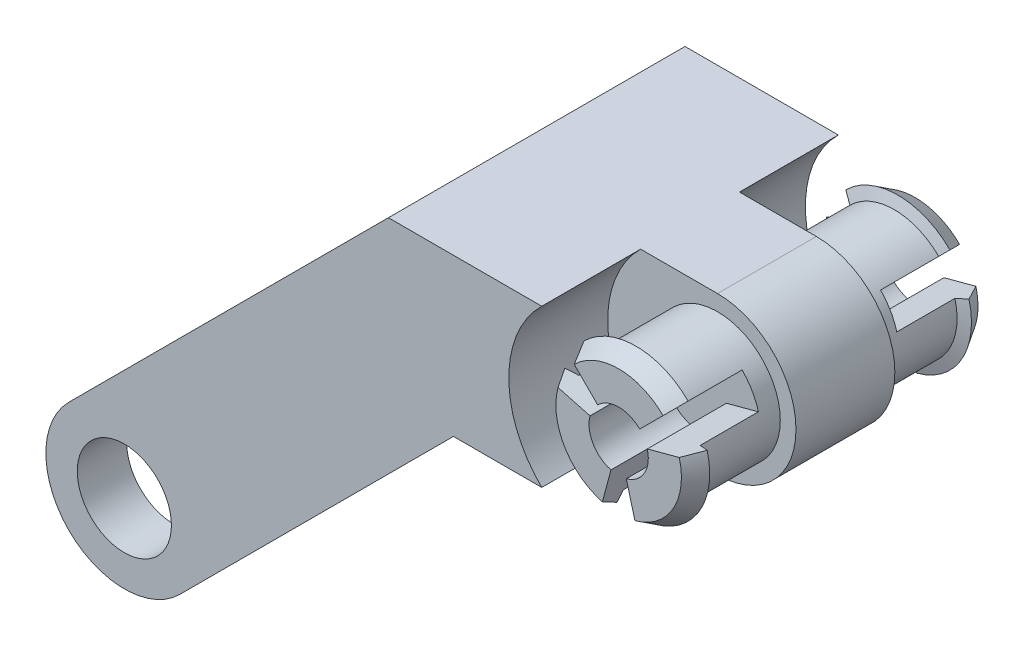
from build123d import *

# Parameters (mm, degrees)
CROQUIS1_R              = 3.96875
SALIENTE_EXTRUIR1_DEPTH = 7.5
CROQUIS2_W              = 2.5
CROQUIS2_H              = 3.96875
CORTAR_EXTRUIR1_DEPTH   = 15
CROQUIS4_R              = 2.38125
CORTAR_EXTRUIR2_DEPTH   = 15
CROQUIS5_R              = 5.55625
CORTAR_EXTRUIR3_DEPTH   = 5
CROQUIS8_W              = 1
CROQUIS8_H              = 1.5
CORTAR_EXTRUIR6_DEPTH   = 4
CROQUIS10_R             = 4
CROQUIS10_R_2           = 1.5
CORTAR_EXTRUIR7_DEPTH   = 1.5


with BuildPart() as part:
    # Croquis1 → Saliente-Extruir1 (new, symmetric)
    with BuildSketch(Plane.XY):
        Circle(CROQUIS1_R)
        with BuildLine():
            Line((13.356089924, 18.96875), (-2.806330038, 2.806330038))
            ThreePointArc((-2.806330038, 2.806330038), (1.518774872, 3.666646895), (3.96875, 0))
            ThreePointArc((3.96875, 0), (3.666646895, -1.518774872), (2.806330038, -2.806330038))
            Line((2.806330038, -2.806330038), (16.643910076, 11.03125))
            Line((16.643910076, 11.03125), (25, 11.03125))
            ThreePointArc((25, 11.03125), (21.03125, 15), (25, 18.96875))
            Line((25, 18.96875), (13.356089924, 18.96875))
        make_face()
        with BuildLine():
            ThreePointArc((28.96875, 15), (27.806330038, 17.806330038), (25, 18.96875))
            Line((25, 18.96875), (25, 11.03125))
            ThreePointArc((25, 11.03125), (27.806330038, 12.193669962), (28.96875, 15))
        make_face()
        with BuildLine():
            Line((25, 11.03125), (25, 18.96875))
            ThreePointArc((25, 18.96875), (21.03125, 15), (25, 11.03125))
        make_face()
        with BuildLine():
            ThreePointArc((28.96875, 15), (27.806330038, 17.806330038), (25, 18.96875))
            Line((25, 18.96875), (25, 11.03125))
            ThreePointArc((25, 11.03125), (27.806330038, 12.193669962), (28.96875, 15))
        make_face()
        with BuildLine():
            Line((25, 11.03125), (25, 18.96875))
            ThreePointArc((25, 18.96875), (21.03125, 15), (25, 11.03125))
        make_face()
    extrude(amount=SALIENTE_EXTRUIR1_DEPTH, both=True)

    # Croquis2 → Cortar-Extruir1 (cut)
    with BuildSketch(Plane(origin=(-2.806330038, 2.806330038, 0), x_dir=(0, 0, 1), z_dir=(-0.7071067811865441, 0.7071067811865509, 0))):
        with Locations((-3.75, -1.984375)):
            Rectangle(CROQUIS2_W, CROQUIS2_H)
        with Locations((3.75, -1.984375)):
            Rectangle(CROQUIS2_W, CROQUIS2_H)
    extrude(amount=-CORTAR_EXTRUIR1_DEPTH, mode=Mode.SUBTRACT)

    # Croquis4 → Cortar-Extruir2 (cut)
    with BuildSketch(Plane.XY.offset(7.5)):
        Circle(CROQUIS4_R)
    extrude(amount=-CORTAR_EXTRUIR2_DEPTH, mode=Mode.SUBTRACT)

    # Croquis5 → Cortar-Extruir3 (cut)
    with BuildSketch(Plane.XY.offset(7.5)):
        with Locations((25, 15)):
            Circle(CROQUIS5_R)
    cortar_extruir3 = extrude(amount=-CORTAR_EXTRUIR3_DEPTH, mode=Mode.SUBTRACT)

    # Simetría1: Cortar-Extruir3 across plane
    add(cortar_extruir3.mirror(Plane.XY), mode=Mode.SUBTRACT)

    # Croquis8 → Revolución1 (revolve)
    with BuildSketch(Plane(origin=(25, 0, 0), x_dir=(0, 0, -1), z_dir=(1, 0, 0)), mode=Mode.PRIVATE) as revoluci_n1_sk:
        Polygon((7.5, 18.175), (7.5, 16.5), (2.5, 16.5), (2.5, 18.175), (6.441294167, 18.175), (6.62, 18.725), align=None)
        with Locations((3, 15.75)):
            Rectangle(CROQUIS8_W, CROQUIS8_H)
    revoluci_n1 = revolve(revoluci_n1_sk.sketch.rotate(Axis((25, 15, -2.5), (0, 0, -1)), 90), axis=Axis((25, 15, -2.5), (0, 0, -1)))

    # Croquis9 → Cortar-Extruir6 (cut)
    with BuildSketch(Plane(origin=(0, 0, -7.5), x_dir=(-1, 0, 0), z_dir=(0, 0, -1))):
        with BuildLine():
            Line((-23.777080012, 10.436000471), (-25, 15))
            Line((-25, 15), (-26.222919988, 10.436000471))
            ThreePointArc((-26.222919988, 10.436000471), (-25, 10.275), (-23.777080012, 10.436000471))
        make_face()
        with BuildLine():
            Line((-29.563999529, 16.222919988), (-25, 15))
            Line((-25, 15), (-28.341079541, 18.341079541))
            ThreePointArc((-28.341079541, 18.341079541), (-29.091970033, 17.3625), (-29.563999529, 16.222919988))
        make_face()
        with BuildLine():
            Line((-21.658920459, 18.341079541), (-25, 15))
            Line((-25, 15), (-20.436000471, 16.222919988))
            ThreePointArc((-20.436000471, 16.222919988), (-20.908029967, 17.3625), (-21.658920459, 18.341079541))
        make_face()
    cortar_extruir6 = extrude(amount=-CORTAR_EXTRUIR6_DEPTH, mode=Mode.SUBTRACT)

    # Simetría2: Revolución1, Cortar-Extruir6 across plane
    add(revoluci_n1.mirror(Plane.XY))
    add(cortar_extruir6.mirror(Plane.XY), mode=Mode.SUBTRACT)

    # Croquis10 → Cortar-Extruir7 (cut, symmetric)
    with BuildSketch(Plane.XY):
        with Locations((10.52444577, 4.911785694)):
            Circle(CROQUIS10_R)
        with Locations((10.52444577, 4.911785694)):
            Circle(CROQUIS10_R_2, mode=Mode.SUBTRACT)
    extrude(amount=CORTAR_EXTRUIR7_DEPTH, both=True, mode=Mode.SUBTRACT)


solid = part.part
